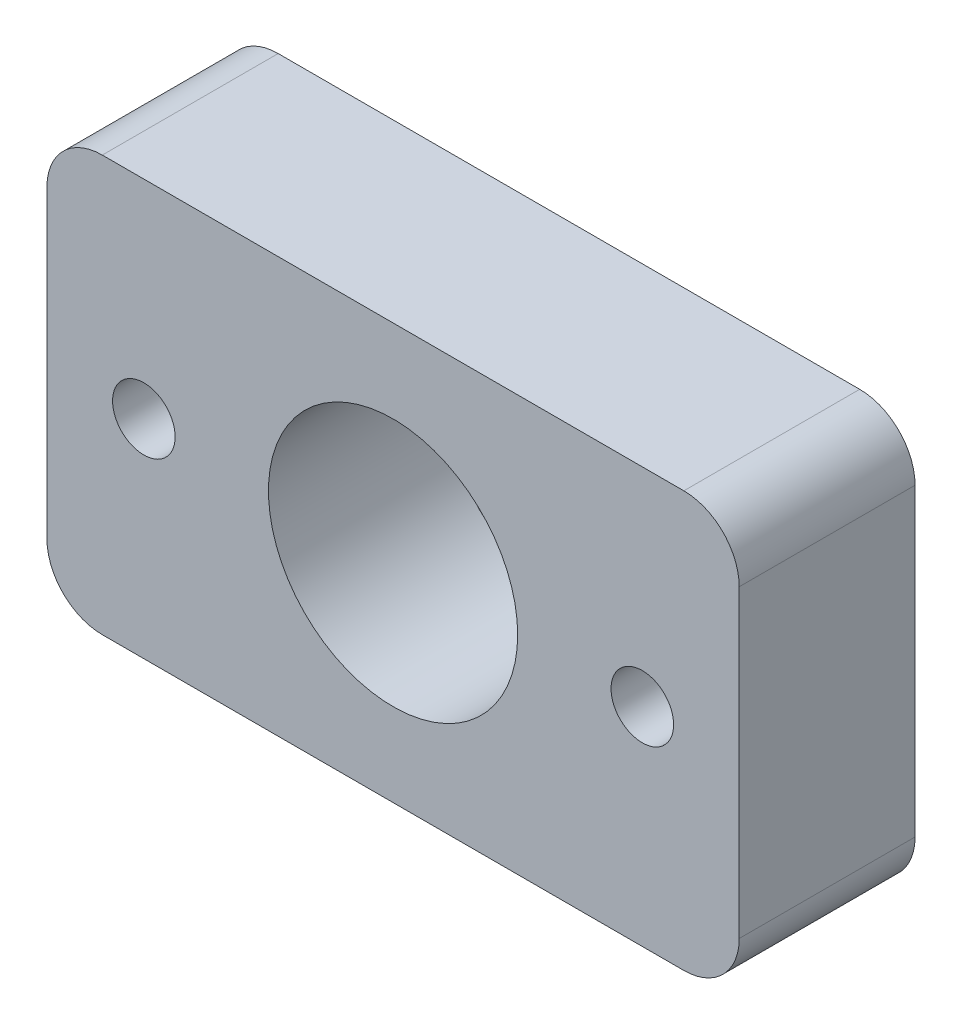
from build123d import *

# Parameters (mm, degrees)
SKETCH1_W             = 25
SKETCH1_H             = 15
SKETCH1_R             = 4.5
SKETCH1_R_2           = 1.1303
BOSS_EXTRUDE1_DEPTH   = 6.35
F_4_40_TAPPED_HOLE1_D = 2.2606
FILLET1_R             = 2


with BuildPart() as part:
    # Sketch1 → Boss-Extrude1 (new body)
    with BuildSketch(Plane.XY):
        with Locations((12.5, -7.5)):
            Rectangle(SKETCH1_W, SKETCH1_H)
        with Locations((12.5, -7.5)):
            Circle(SKETCH1_R, mode=Mode.SUBTRACT)
        with Locations((3.5, -7.5)):
            Circle(SKETCH1_R_2, mode=Mode.SUBTRACT)
        with Locations((21.5, -7.5)):
            Circle(SKETCH1_R_2, mode=Mode.SUBTRACT)
    extrude(amount=BOSS_EXTRUDE1_DEPTH)

    # #4-40 Tapped Hole1 (through all)
    with Locations(Plane(origin=(21.5, -7.5, 6.35), x_dir=(1, 0, 0), z_dir=(0, 0, 1))):
        with Locations((0, 0), (-18, 0)):
            Hole(F_4_40_TAPPED_HOLE1_D / 2)

    # Fillet1
    fillet1_edges = [part.edges().sort_by_distance(p)[0] for p in [
        (0, 0, 3.175),
        (25, 0, 3.175),
        (25, -15, 3.175),
        (0, -15, 3.175),
    ]]
    fillet(fillet1_edges, radius=FILLET1_R)


solid = part.part
